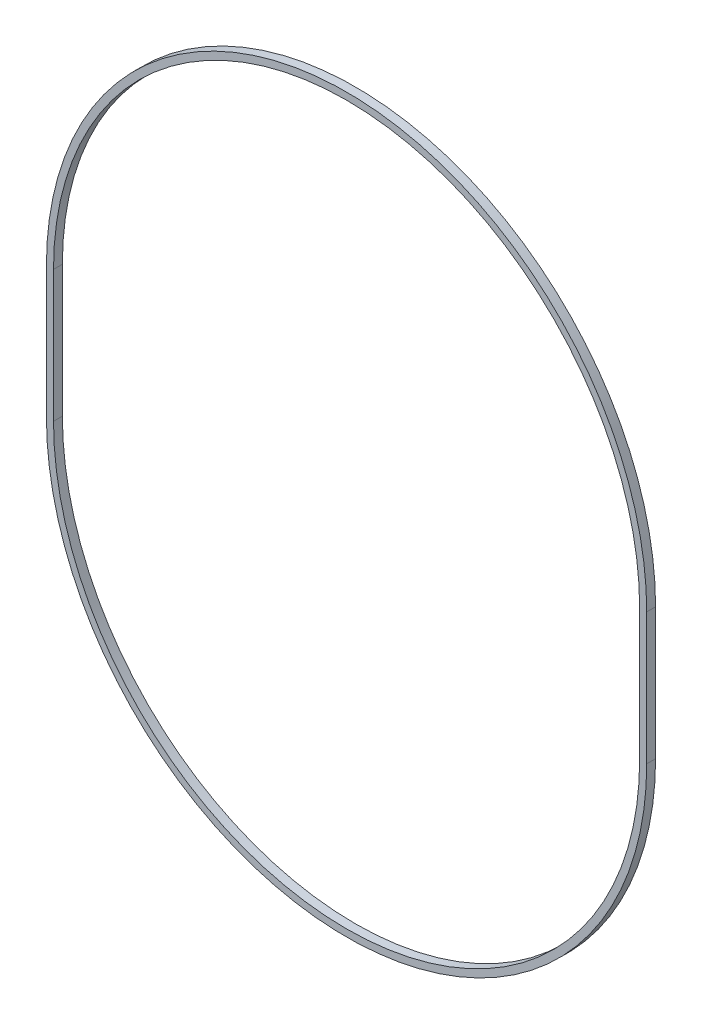
from build123d import *

# Parameters (mm, degrees)
BOSS_EXTRUDE1_DEPTH = 1.875


with BuildPart() as part:
    # Sketch2 → Boss-Extrude1 (new, symmetric)
    with BuildSketch(Plane.XY):
        with BuildLine():
            Line((-127.19, 27.875), (-127.19, -27.875))
            ThreePointArc((-127.19, -27.875), (0, -155.065), (127.19, -27.875))
            Line((127.19, -27.875), (127.19, 27.875))
            ThreePointArc((127.19, 27.875), (0, 155.065), (-127.19, 27.875))
        make_face()
        with BuildLine():
            ThreePointArc((124.19, 27.875), (0, 152.065), (-124.19, 27.875))
            Line((-124.19, 27.875), (-124.19, -27.875))
            ThreePointArc((-124.19, -27.875), (0, -152.065), (124.19, -27.875))
            Line((124.19, -27.875), (124.19, 27.875))
        make_face(mode=Mode.SUBTRACT)
    extrude(amount=BOSS_EXTRUDE1_DEPTH, both=True)


solid = part.part
